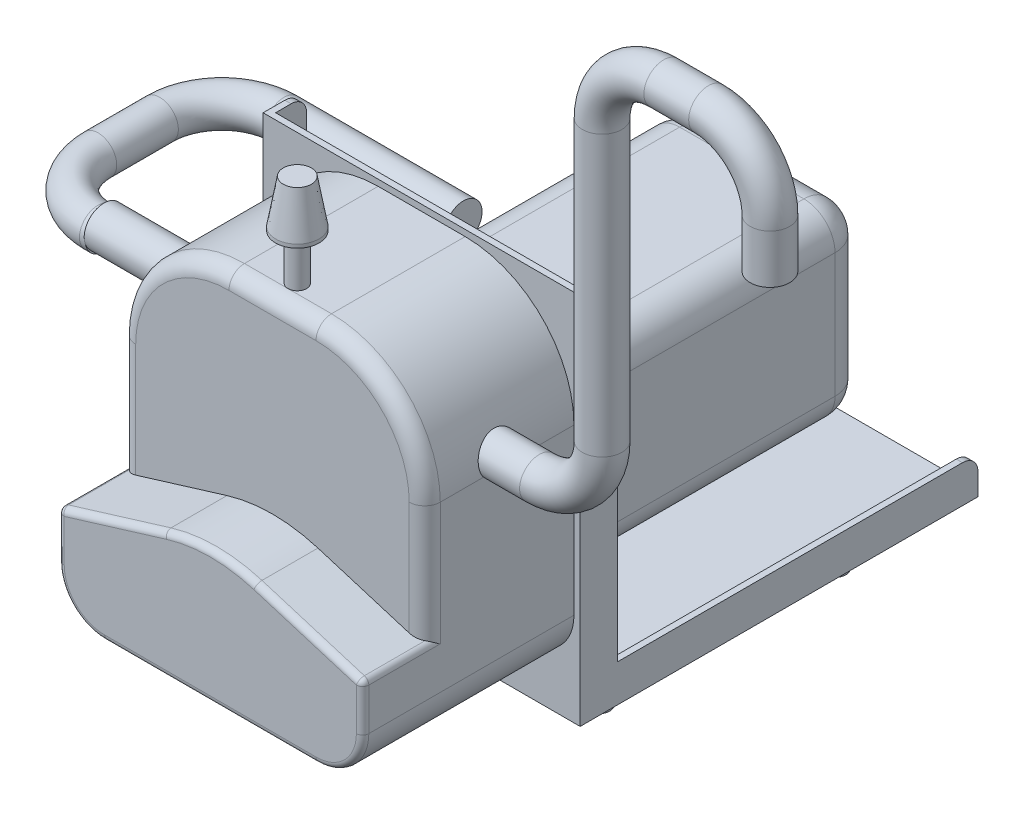
from build123d import *

# Parameters (mm, degrees)
SKETCH1_W           = 102
SKETCH1_H           = 120
BOSS_EXTRUDE1_DEPTH = 2
SKETCH2_W           = 102
SKETCH2_H           = 128
BOSS_EXTRUDE2_DEPTH = 2
BOSS_EXTRUDE3_DEPTH = 2
FILLET1_R           = 5
SKETCH5_R           = 3.5
SKETCH5_R_2         = 2.5
BOSS_EXTRUDE4_DEPTH = 6
SKETCH4_W           = 98
SKETCH4_H           = 103
BOSS_EXTRUDE5_DEPTH = 68
FILLET2_R           = 35
FILLET3_R           = 15
CUT_EXTRUDE1_DEPTH  = 20
FILLET4_R           = 5
FILLET5_R           = 2
SKETCH8_W           = 60
SKETCH8_H           = 60
BOSS_EXTRUDE6_DEPTH = 111
FILLET6_R           = 10
SKETCH10_R          = 3
BOSS_EXTRUDE7_DEPTH = 29.85
SKETCH11_R          = 7
BOSS_EXTRUDE8_DEPTH = 15.15
CHAMFER1_SIZE       = 14
CHAMFER1_SIZE2      = 2.46857773
CUT_EXTRUDE2_DEPTH  = 38
SKETCH12_R          = 6.35
SKETCH12_R_2        = 5.08
SCALE1_SCALE        = 0.5
SWEEP3_PROFILE_R    = 3


with BuildPart() as part:
    # Sketch1 → Boss-Extrude1 (new body)
    with BuildSketch(Plane.XY):
        Rectangle(SKETCH1_W, SKETCH1_H)
    extrude(amount=BOSS_EXTRUDE1_DEPTH)

    # Sketch2 → Boss-Extrude2 (add)
    with BuildSketch(Plane.XZ.offset(60)):
        with Locations((0, -62)):
            Rectangle(SKETCH2_W, SKETCH2_H)
    extrude(amount=-BOSS_EXTRUDE2_DEPTH)

    # Sketch3 → Boss-Extrude3 (add)
    with BuildSketch(Plane(origin=(51, 0, 0), x_dir=(0, 0, -1), z_dir=(1, 0, 0))):
        Polygon((-2, 60), (10, 60), (10, -48), (126, -48), (126, -60), (-2, -60), (-2, -48), align=None)
    boss_extrude3 = extrude(amount=-BOSS_EXTRUDE3_DEPTH)

    # Mirror1: Boss-Extrude3 across plane
    add(boss_extrude3.mirror(Plane(origin=(0, 0, 0), x_dir=(0, 0, 1), z_dir=(1, 0, 0))))

    # Fillet1
    fillet1_edges = [part.edges().sort_by_distance(p)[0] for p in [
        (50, -48, -126),
        (50, 60, -10),
        (-50, -48, -126),
        (-50, 60, -10),
    ]]
    fillet(fillet1_edges, radius=FILLET1_R)

    # Sketch5 → Boss-Extrude4 (add)
    # profile 1 of 4: a face of its own
    with BuildSketch(Plane.XZ.offset(60)):
        with Locations(Location((-42, -13, 0), (0, 0, 90))):
            Circle(SKETCH5_R)
        with Locations(Location((-42, -13, 0), (0, 0, 270))):
            Circle(SKETCH5_R_2, mode=Mode.SUBTRACT)
    # profile 2 of 4: a face of its own
    with BuildSketch(Plane.XZ.offset(60)):
        with Locations(Location((42, -13, 0), (0, 0, 90))):
            Circle(SKETCH5_R)
        with Locations(Location((42, -13, 0), (0, 0, 270))):
            Circle(SKETCH5_R_2, mode=Mode.SUBTRACT)
    # profile 3 of 4: a face of its own
    with BuildSketch(Plane.XZ.offset(60)):
        with Locations(Location((-42, -89, 0), (0, 0, 90))):
            Circle(SKETCH5_R)
        with Locations(Location((-42, -89, 0), (0, 0, 270))):
            Circle(SKETCH5_R_2, mode=Mode.SUBTRACT)
    # profile 4 of 4: a face of its own
    with BuildSketch(Plane.XZ.offset(60)):
        with Locations(Location((42, -89, 0), (0, 0, 90))):
            Circle(SKETCH5_R)
        with Locations(Location((42, -89, 0), (0, 0, 270))):
            Circle(SKETCH5_R_2, mode=Mode.SUBTRACT)
    extrude(amount=BOSS_EXTRUDE4_DEPTH)

    # Sketch4 → Boss-Extrude5 (add)
    with BuildSketch(Plane.XY.offset(2)):
        with Locations((0, 6.5)):
            Rectangle(SKETCH4_W, SKETCH4_H)
    extrude(amount=BOSS_EXTRUDE5_DEPTH)

    # Fillet2
    fillet2_edges = [part.edges().sort_by_distance(p)[0] for p in [
        (-49, 58, 36),
        (49, 58, 36),
    ]]
    fillet(fillet2_edges, radius=FILLET2_R)

    # Fillet3
    fillet3_edges = [part.edges().sort_by_distance(p)[0] for p in [
        (-49, -45, 36),
        (49, -45, 36),
    ]]
    fillet(fillet3_edges, radius=FILLET3_R)

    # Sketch6 → Cut-Extrude1 (cut)
    with BuildSketch(Plane.XY.offset(70)):
        with BuildLine():
            Line((-49, -15), (-14.635713605, -4.480320491))
            ThreePointArc((-14.635713605, -4.480320491), (0, -2.290318267), (14.635713605, -4.480320491))
            Line((14.635713605, -4.480320491), (49, -15))
            Line((49, -15), (49, 23))
            ThreePointArc((49, 23), (38.748737342, 47.748737342), (14, 58))
            Line((14, 58), (-14, 58))
            ThreePointArc((-14, 58), (-38.748737342, 47.748737342), (-49, 23))
            Line((-49, 23), (-49, -15))
        make_face()
    extrude(amount=-CUT_EXTRUDE1_DEPTH, mode=Mode.SUBTRACT)

    # Fillet4
    fillet4_edges = [part.edges().sort_by_distance(p)[0] for p in [
        (-49, 4, 50),
        (-38.748737342, 47.748737342, 50),
        (0, 58, 50),
        (38.748737342, 47.748737342, 50),
        (49, 4, 50),
    ]]
    fillet(fillet4_edges, radius=FILLET4_R)

    # Fillet5
    fillet5_edges = [part.edges().sort_by_distance(p)[0] for p in [
        (-31.817856802, -9.740160246, 70),
        (31.817856802, -9.740160246, 70),
        (-49, -15, 57.5),
        (49, -15, 57.5),
        (0, -2.290318267, 70),
        (-49, -22.5, 70),
        (-44.606601718, -40.606601718, 70),
        (0, -45, 70),
        (44.606601718, -40.606601718, 70),
        (49, -22.5, 70),
    ]]
    fillet(fillet5_edges, radius=FILLET5_R)

    # Sketch8 → Boss-Extrude6 (add)
    with BuildSketch(Plane(origin=(0, 0, 0), x_dir=(-1, 0, 0), z_dir=(0, 0, -1))):
        with Locations((0, -10)):
            Rectangle(SKETCH8_W, SKETCH8_H)
    extrude(amount=BOSS_EXTRUDE6_DEPTH)

    # Fillet6
    fillet6_edges = [part.edges().sort_by_distance(p)[0] for p in [
        (-30, -40, -55.5),
        (-30, 20, -55.5),
        (30, 20, -55.5),
        (30, -40, -55.5),
        (0, -40, -111),
        (-30, -10, -111),
        (0, 20, -111),
        (30, -10, -111),
    ]]
    fillet(fillet6_edges, radius=FILLET6_R)

    # Sketch10 → Boss-Extrude7 (add)
    with BuildSketch(Plane(origin=(0, 58, 0), x_dir=(1, 0, 0), z_dir=(0, 1, 0))):
        with Locations(Location((0, -42, 0), (0, 0, 270))):
            Circle(SKETCH10_R)
    extrude(amount=BOSS_EXTRUDE7_DEPTH)

    # Sketch11 → Boss-Extrude8 (add)
    with BuildSketch(Plane(origin=(0, 87.85, 0), x_dir=(1, 0, 0), z_dir=(0, 1, 0))):
        with Locations(Location((0, -42, 0), (0, 0, 270))):
            Circle(SKETCH11_R)
    extrude(amount=-BOSS_EXTRUDE8_DEPTH)

    # Chamfer1
    chamfer1_edges = [part.edges().sort_by_distance(p)[0] for p in [
        (0, 87.85, 35),
    ]]
    chamfer1_side = [part.faces().sort_by_distance(p)[0] for p in [
        (0, 80.275, 35),
    ]]
    chamfer(chamfer1_edges, length=CHAMFER1_SIZE, length2=CHAMFER1_SIZE2, reference=chamfer1_side[0])

    # Sketch15 → Cut-Extrude2 (cut)
    with BuildSketch(Plane.XY.offset(2)):
        with BuildLine():
            Line((44, -13.469387755), (44, 23))
            ThreePointArc((44, 23), (35.213203436, 44.213203436), (14, 53))
            Line((14, 53), (-14, 53))
            ThreePointArc((-14, 53), (-35.213203436, 44.213203436), (-44, 23))
            Line((-44, 23), (-44, -13.469387755))
            Line((-44, -13.469387755), (-44, -16.479367833))
            Line((-44, -16.479367833), (-44, -30))
            ThreePointArc((-44, -30), (-41.071067812, -37.071067812), (-34, -40))
            Line((-34, -40), (34, -40))
            ThreePointArc((34, -40), (41.071067812, -37.071067812), (44, -30))
            Line((44, -30), (44, -16.479367833))
            Line((44, -16.479367833), (44, -13.469387755))
        make_face()
    extrude(amount=CUT_EXTRUDE2_DEPTH, mode=Mode.SUBTRACT)

    # Sweep1: sweep along a path in Sketch13
    with BuildLine(Plane.XY.offset(50)) as sweep1_path:
        Line((136.43558857, 121.518911515), (136.43558857, 137.202148015))
        ThreePointArc((136.43558857, 137.202148015), (130.577724194, 151.344283639), (116.43558857, 157.202148015))
        Line((116.43558857, 157.202148015), (102.030073252, 157.202148015))
        ThreePointArc((102.030073252, 157.202148015), (87.887937628, 151.344283639), (82.030073252, 137.202148015))
        Line((82.030073252, 137.202148015), (82.030073252, 47.244012604))
        ThreePointArc((82.030073252, 47.244012604), (76.172208876, 33.10187698), (62.030073252, 27.244012604))
        Line((62.030073252, 27.244012604), (-78.059372715, 27.244012604))
    # Sketch12 → Sweep1 (sweep)
    with BuildSketch(Plane.ZY.offset(49)):
        with Locations((26.170637514, 27.044602661)):
            Circle(SKETCH12_R)
        with Locations((26.170637514, 27.044602661)):
            Circle(SKETCH12_R_2, mode=Mode.SUBTRACT)
    sweep(path=sweep1_path.line)


with BuildPart() as part_1:
    # Scale1: scaled about (1.261610661, -7.880234514, -18.455059792)
    add(part.part.scale(SCALE1_SCALE).moved(Location((0.63080533, -3.940117257, -9.227529896))))

    # Sweep3: sweep along a path in Sketch16
    with BuildLine(Plane(origin=(0, 9, 0), x_dir=(1, 0, 0), z_dir=(0, 1, 0))) as sweep3_path:
        Line((-38.398879936, -3.857781055), (-39.334688954, -3.857781055))
        ThreePointArc((-39.334688954, -3.857781055), (-46.456258944, -0.907930179), (-49.406109819, 6.213639811))
        Line((-49.406109819, 6.213639811), (-49.406109819, 16.127635681))
        ThreePointArc((-49.406109819, 16.127635681), (-46.477177631, 23.198703493), (-39.406109819, 26.127635681))
        Line((-39.406109819, 26.127635681), (-10.548683373, 26.127635681))
    # Sweep3 profile (on start of the path) → Sweep3 (sweep)
    with BuildSketch(Plane(origin=(-38.398879936, 9, 3.857781055), x_dir=(0, 0, -1), z_dir=(-1, 0, 0))):
        Circle(SWEEP3_PROFILE_R)
    sweep(path=sweep3_path.line)


solid = part_1.part
